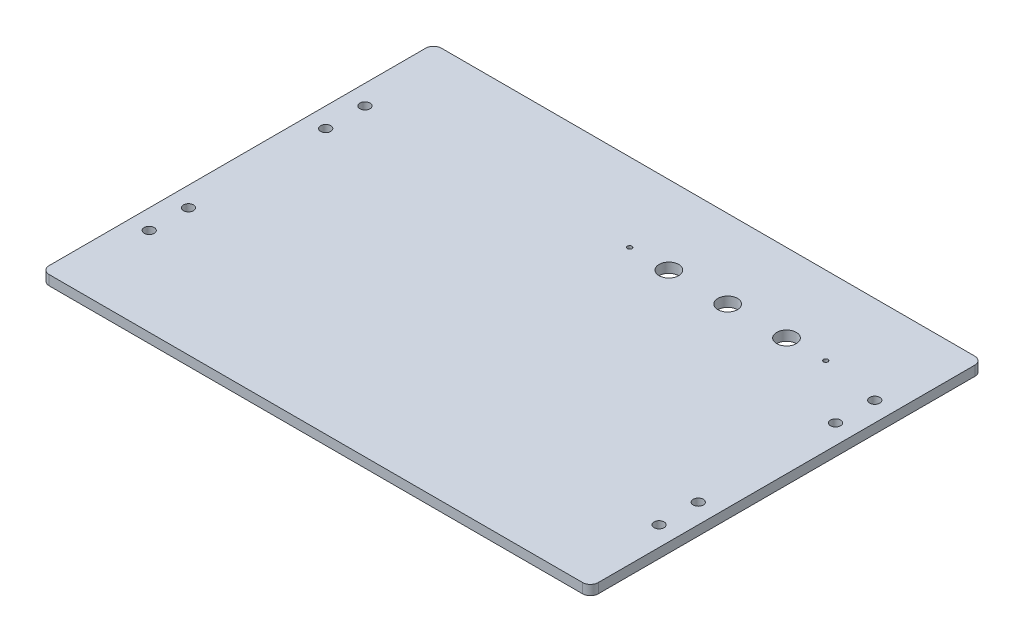
from build123d import *

# Parameters (mm, degrees)
SKETCH1_W             = 355.6
SKETCH1_H             = 254
BOSS_EXTRUDE1_DEPTH   = 6.35
SKETCH4_R             = 3.2639
CUT_EXTRUDE3_DEPTH    = 219.591313871
SKETCH5_R             = 6.35
SWITCH_MOUNTING_DEPTH = 219.591313871
SKETCH6_R             = 1.4605
CUT_EXTRUDE4_DEPTH    = 219.591313871
FILLET2_R             = 5.08


with BuildPart() as part:
    # Sketch1 → Boss-Extrude1 (new body)
    with BuildSketch(Plane(origin=(0, 0, 0), x_dir=(1, 0, 0), z_dir=(0, 1, 0))):
        Rectangle(SKETCH1_W, SKETCH1_H)
    extrude(amount=BOSS_EXTRUDE1_DEPTH)

    # Sketch4 → Cut-Extrude3 (cut, through all)
    with BuildSketch(Plane(origin=(0, 6.35, 0), x_dir=(1, 0, 0), z_dir=(0, 1, 0))):
        with Locations(Location((-165.1, 69.85, 0), (0, 0, 270))):
            Circle(SKETCH4_R)
        with Locations(Location((-165.1, 44.45, 0), (0, 0, 270))):
            Circle(SKETCH4_R)
        with Locations(Location((-165.1, -44.45, 0), (0, 0, 270))):
            Circle(SKETCH4_R)
        with Locations(Location((-165.1, -69.85, 0), (0, 0, 270))):
            Circle(SKETCH4_R)
        with Locations(Location((165.1, -69.85, 0), (0, 0, 90))):
            Circle(SKETCH4_R)
        with Locations(Location((165.1, -44.45, 0), (0, 0, 90))):
            Circle(SKETCH4_R)
        with Locations(Location((165.1, 44.45, 0), (0, 0, 90))):
            Circle(SKETCH4_R)
        with Locations(Location((165.1, 69.85, 0), (0, 0, 90))):
            Circle(SKETCH4_R)
    extrude(amount=-CUT_EXTRUDE3_DEPTH, mode=Mode.SUBTRACT)

    # Sketch5 → Switch Mounting (cut, through all)
    with BuildSketch(Plane(origin=(0, 6.35, 0), x_dir=(1, 0, 0), z_dir=(0, 1, 0))):
        with Locations(Location((25.4, 76.2, 0), (0, 0, 270))):
            Circle(SKETCH5_R)
        with Locations(Location((63.5, 76.2, 0), (0, 0, 270))):
            Circle(SKETCH5_R)
        with Locations(Location((101.6, 76.2, 0), (0, 0, 270))):
            Circle(SKETCH5_R)
    extrude(amount=-SWITCH_MOUNTING_DEPTH, mode=Mode.SUBTRACT)

    # Sketch6 → Cut-Extrude4 (cut, through all)
    with BuildSketch(Plane(origin=(0, 6.35, 0), x_dir=(1, 0, 0), z_dir=(0, 1, 0))):
        with Locations(Location((127, 76.2, 0), (0, 0, 270))):
            Circle(SKETCH6_R)
        with Locations(Location((0, 76.2, 0), (0, 0, 270))):
            Circle(SKETCH6_R)
    extrude(amount=-CUT_EXTRUDE4_DEPTH, mode=Mode.SUBTRACT)

    # Fillet2
    fillet2_edges = [part.edges().sort_by_distance(p)[0] for p in [
        (177.8, 3.175, 127),
        (-177.8, 3.175, 127),
        (-177.8, 3.175, -127),
        (177.8, 3.175, -127),
    ]]
    fillet(fillet2_edges, radius=FILLET2_R)


solid = part.part
